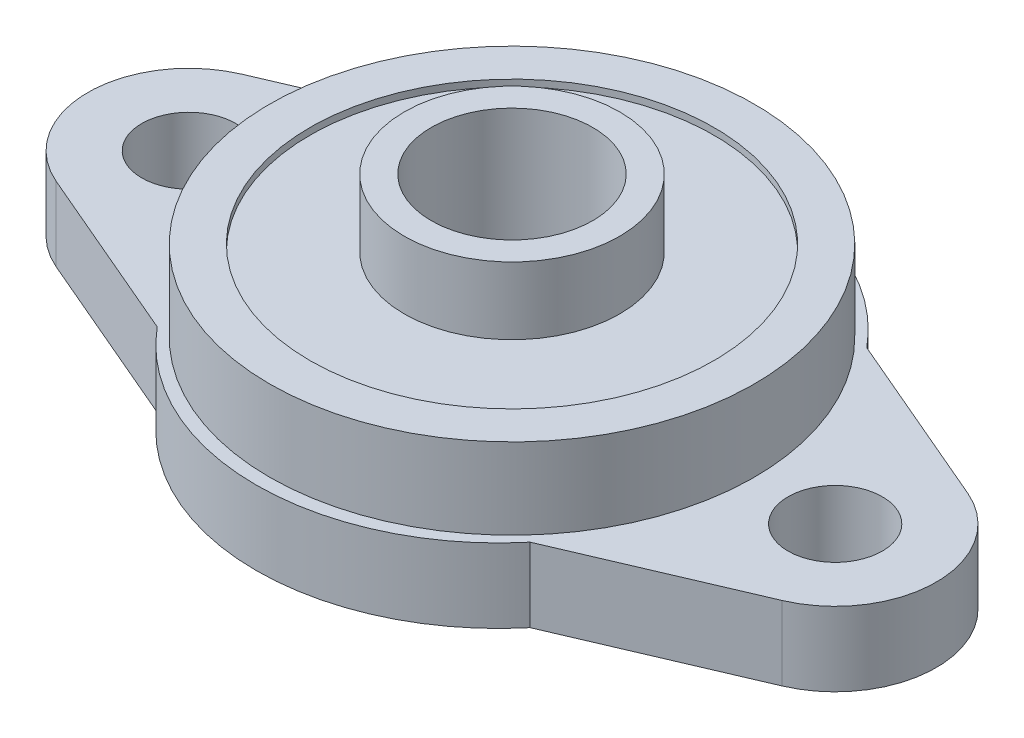
from build123d import *

# Parameters (mm, degrees)
SKETCH1_R           = 3.5
SKETCH1_R_2         = 6
BOSS_EXTRUDE1_DEPTH = 5.5
SKETCH1_3_R         = 18
SKETCH1_3_R_2       = 15
BOSS_EXTRUDE2_DEPTH = 6
SKETCH1_4_R         = 15
SKETCH1_4_R_2       = 8
BOSS_EXTRUDE3_DEPTH = 5.5
SKETCH1_5_R         = 8
SKETCH1_5_R_2       = 6
BOSS_EXTRUDE4_DEPTH = 10.5
SKETCH2_R           = 15
SKETCH2_R_2         = 8
CUT_EXTRUDE1_DEPTH  = 0.5


with BuildPart() as part:
    # Sketch1 → Boss-Extrude1 (new body)
    with BuildSketch(Plane(origin=(0, 0, 0), x_dir=(1, 0, 0), z_dir=(0, 1, 0))):
        with BuildLine():
            Line((-13.847382424, 12.5), (-26.949557882, 6.895658656))
            ThreePointArc((-26.949557882, 6.895658656), (-31.5, 0), (-26.949557882, -6.895658656))
            Line((-26.949557882, -6.895658656), (-13.847382424, -12.5))
            ThreePointArc((-13.847382424, -12.5), (0, -19), (13.847382424, -12.5))
            Line((13.847382424, -12.5), (26.949557882, -6.895658656))
            ThreePointArc((26.949557882, -6.895658656), (31.5, 0), (26.949557882, 6.895658656))
            Line((26.949557882, 6.895658656), (13.847382424, 12.5))
            ThreePointArc((13.847382424, 12.5), (0, 19), (-13.847382424, 12.5))
        make_face()
        with Locations((24, 0)):
            Circle(SKETCH1_R, mode=Mode.SUBTRACT)
        with Locations((-24, 0)):
            Circle(SKETCH1_R, mode=Mode.SUBTRACT)
        Circle(SKETCH1_R_2, mode=Mode.SUBTRACT)
    extrude(amount=-BOSS_EXTRUDE1_DEPTH)

    # Sketch1<3> → Boss-Extrude2 (add)
    with BuildSketch(Plane(origin=(0, 0, 0), x_dir=(1, 0, 0), z_dir=(0, 1, 0))):
        Circle(SKETCH1_3_R)
        Circle(SKETCH1_3_R_2, mode=Mode.SUBTRACT)
    extrude(amount=BOSS_EXTRUDE2_DEPTH)

    # Sketch1<4> → Boss-Extrude3 (add)
    with BuildSketch(Plane(origin=(0, 0, 0), x_dir=(1, 0, 0), z_dir=(0, 1, 0))):
        Circle(SKETCH1_4_R)
        Circle(SKETCH1_4_R_2, mode=Mode.SUBTRACT)
    extrude(amount=BOSS_EXTRUDE3_DEPTH)

    # Sketch1<5> → Boss-Extrude4 (add)
    with BuildSketch(Plane(origin=(0, 0, 0), x_dir=(1, 0, 0), z_dir=(0, 1, 0))):
        Circle(SKETCH1_5_R)
        Circle(SKETCH1_5_R_2, mode=Mode.SUBTRACT)
    extrude(amount=BOSS_EXTRUDE4_DEPTH)

    # Sketch2 → Cut-Extrude1 (cut)
    with BuildSketch(Plane.XZ.offset(5.5)):
        Circle(SKETCH2_R)
        Circle(SKETCH2_R_2, mode=Mode.SUBTRACT)
    extrude(amount=-CUT_EXTRUDE1_DEPTH, mode=Mode.SUBTRACT)


solid = part.part
